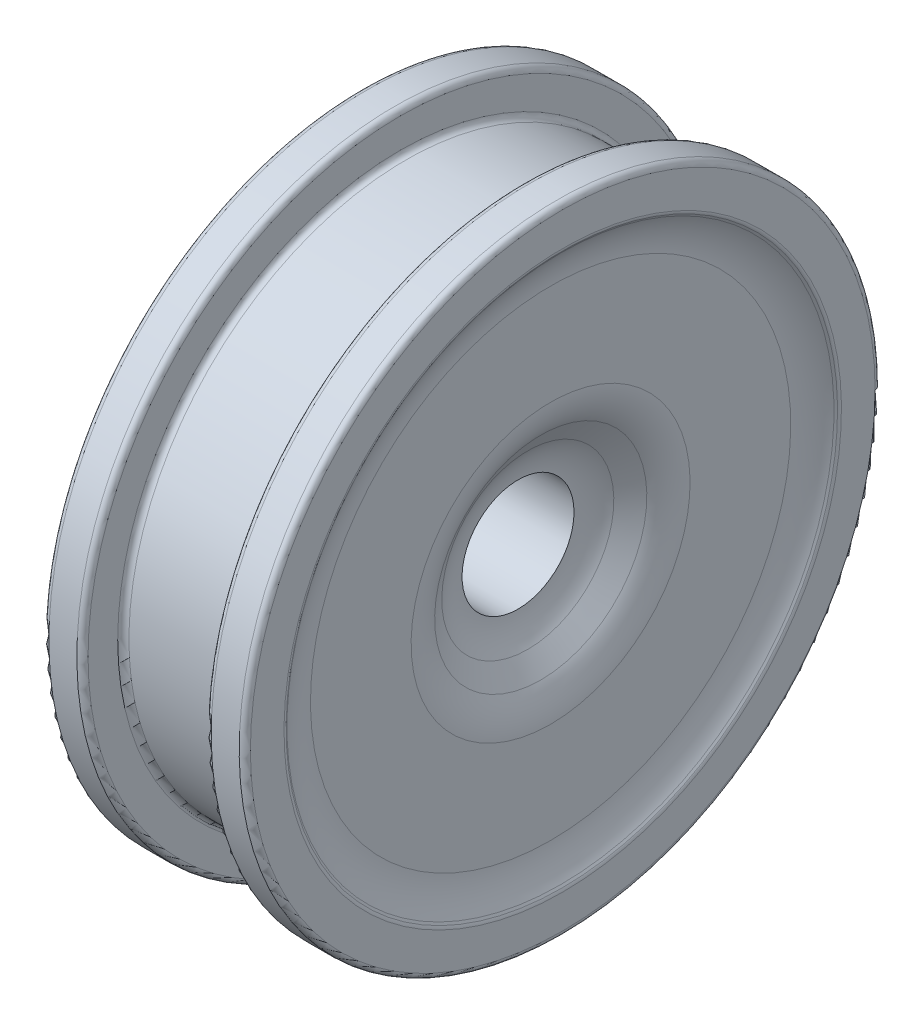
from build123d import *

# Parameters (mm, degrees)
KES_EKSTR_ZYON1_DEPTH      = 412.596890264
KES_EKSTR_ZYON1_DEPTH_BACK = 412.596890264
IZIM2_R                    = 50


with BuildPart() as part:
    # Çizim1 → Döndür1 (revolve)
    with BuildSketch(Plane.XY):
        with BuildLine():
            Line((90, 248.973777592), (90, 279))
            ThreePointArc((90, 279), (88.535533906, 282.535533906), (85, 284))
            Line((85, 284), (60, 284))
            ThreePointArc((60, 284), (56.464466094, 282.535533906), (55, 279))
            Line((55, 279), (55, 252.5))
            ThreePointArc((55, 252.5), (53.535533906, 248.964466094), (50, 247.5))
            Line((50, 247.5), (-50, 247.5))
            ThreePointArc((-50, 247.5), (-53.535533906, 248.964466094), (-55, 252.5))
            Line((-55, 252.5), (-55, 279))
            ThreePointArc((-55, 279), (-56.464466094, 282.535533906), (-60, 284))
            Line((-60, 284), (-85, 284))
            ThreePointArc((-85, 284), (-88.535533906, 282.535533906), (-90, 279))
            Line((-90, 279), (-90, 248.973777592))
            ThreePointArc((-90, 248.973777592), (-89.795998546, 247.560130554), (-89.200640822, 246.261837937))
            Line((-89.200640822, 246.261837937), (-87.945192346, 244.317219402))
            ThreePointArc((-87.945192346, 244.317219402), (-81.396257376, 230.036000616), (-79.152241383, 214.485883207))
            Line((-79.152241383, 214.485883207), (-79.152241383, 124.592908011))
            ThreePointArc((-79.152241383, 124.592908011), (-76.90822539, 109.042790602), (-70.359290421, 94.761571816))
            Line((-70.359290421, 94.761571816), (-58.792950962, 76.845967531))
            ThreePointArc((-58.792950962, 76.845967531), (-52.244015993, 62.564748745), (-50, 47.014631335))
            Line((-50, 47.014631335), (-50, 0))
            Line((-50, 0), (50, 0))
            Line((50, 0), (50, 47.014631335))
            ThreePointArc((50, 47.014631335), (52.244015993, 62.564748745), (58.792950962, 76.845967531))
            Line((58.792950962, 76.845967531), (70.359290421, 94.761571816))
            ThreePointArc((70.359290421, 94.761571816), (76.90822539, 109.042790602), (79.152241383, 124.592908011))
            Line((79.152241383, 124.592908011), (79.152241383, 214.485883207))
            ThreePointArc((79.152241383, 214.485883207), (81.396257376, 230.036000616), (87.945192346, 244.317219402))
            Line((87.945192346, 244.317219402), (89.200640822, 246.261837937))
            ThreePointArc((89.200640822, 246.261837937), (89.795998546, 247.560130554), (90, 248.973777592))
        make_face()
    revolve(axis=Axis((-50, 0, 0), (1, 0, 0)))

    # Çizim2 → Kes-Ekstrüzyon1 (cut, two sides: drawn at the far end of the back side and taken through both)
    with BuildSketch(Plane(origin=(0, 0, 0), x_dir=(0, 0, -1), z_dir=(1, 0, 0)).offset(-KES_EKSTR_ZYON1_DEPTH_BACK)):
        Circle(IZIM2_R)
    extrude(amount=KES_EKSTR_ZYON1_DEPTH + KES_EKSTR_ZYON1_DEPTH_BACK, mode=Mode.SUBTRACT)


solid = part.part
